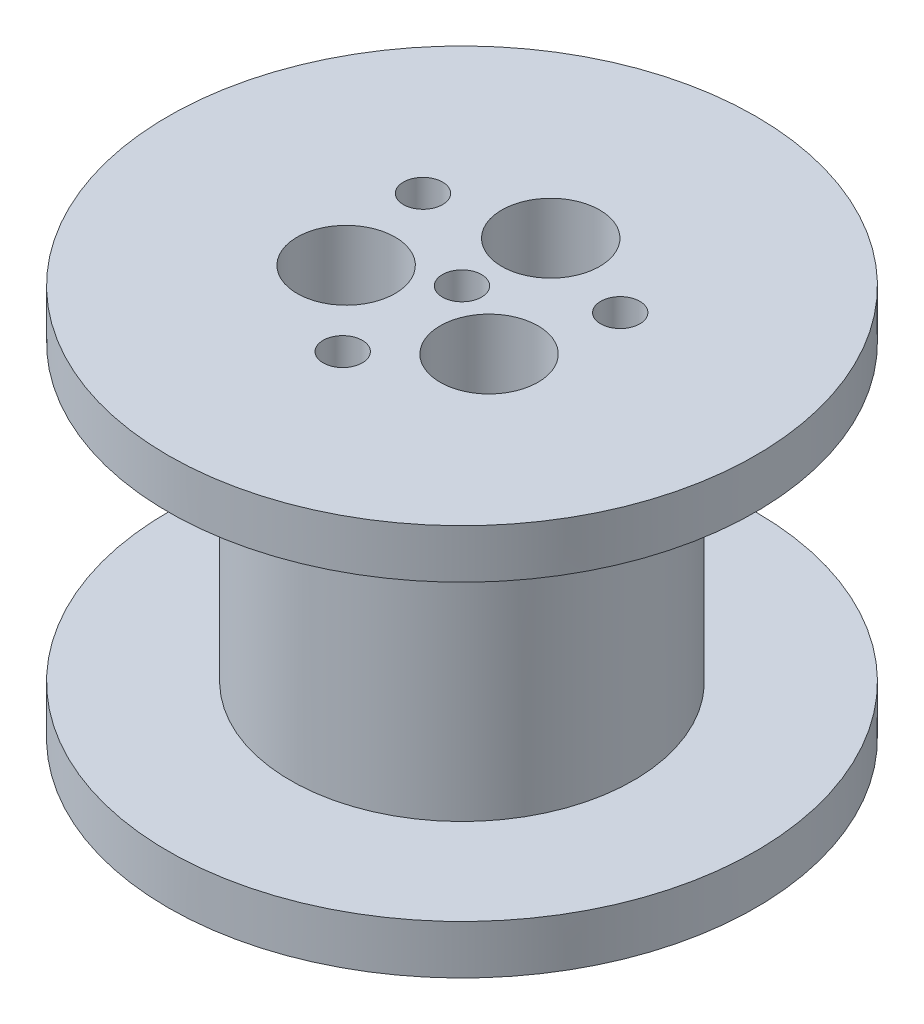
from build123d import *

# Parameters (mm, degrees)
SKETCH1_R           = 30
BOSS_EXTRUDE1_DEPTH = 40
CUT_EXTRUDE1_START  = -5
SKETCH2_OUTSIDE_W   = 80.762
SKETCH2_OUTSIDE_H   = 80.762
SKETCH2_OUTSIDE_R   = 17.5
CUT_EXTRUDE1_DEPTH  = 30
SKETCH3_R           = 2
CUT_EXTRUDE2_DEPTH  = 59.309518948
CUT_EXTRUDE3_DEPTH  = 59.309518948
CUT_EXTRUDE4_REACH  = 57
SKETCH5_R           = 2
SKETCH8_R           = 2
CUT_EXTRUDE5_DEPTH  = 59.309518948


with BuildPart() as part:
    # Sketch1 → Boss-Extrude1 (new body)
    with BuildSketch(Plane(origin=(0, 0, 0), x_dir=(1, 0, 0), z_dir=(0, 1, 0))):
        with Locations(Location((0, 0, 0), (0, 0, 270))):
            Circle(SKETCH1_R)
    extrude(amount=BOSS_EXTRUDE1_DEPTH)

    # Sketch2 outside → Cut-Extrude1 (cut)
    with BuildSketch(Plane.XZ.offset(CUT_EXTRUDE1_START)):
        Rectangle(SKETCH2_OUTSIDE_W, SKETCH2_OUTSIDE_H)
        with Locations(Location((0, 0, 0), (0, 0, 270))):
            Circle(SKETCH2_OUTSIDE_R, mode=Mode.SUBTRACT)
    extrude(amount=-CUT_EXTRUDE1_DEPTH, mode=Mode.SUBTRACT)

    # Sketch3 → Cut-Extrude2 (cut, through all)
    with BuildSketch(Plane.XZ):
        with Locations(Location((0, 0, 0), (0, 0, 270))):
            Circle(SKETCH3_R)
    extrude(amount=-CUT_EXTRUDE2_DEPTH, mode=Mode.SUBTRACT)

    # Sketch4 → Cut-Extrude3 (cut, through all)
    with BuildSketch(Plane.XZ):
        with BuildLine():
            ThreePointArc((5.314601624, -8.562564428), (0.136244015, -3.747524192), (-4.678796221, -8.925881801))
            Line((-4.678796221, -8.925881801), (5.314601624, -8.562564428))
        make_face()
        with BuildLine():
            Line((5.314601624, -8.562564428), (-4.678796221, -8.925881801))
            ThreePointArc((-4.678796221, -8.925881801), (0.40874704, -13.743397777), (5.317902702, -8.744223114))
            ThreePointArc((5.317902702, -8.744223114), (5.317077364, -8.653378776), (5.314601624, -8.562564428))
        make_face()
        with BuildLine():
            ThreePointArc((4.758097504, 8.883862231), (3.177329144, 1.991752874), (10.069438501, 0.410984514))
            Line((10.069438501, 0.410984514), (4.758097504, 8.883862231))
        make_face()
        with BuildLine():
            Line((4.758097504, 8.883862231), (10.069438501, 0.410984514))
            ThreePointArc((10.069438501, 0.410984514), (11.788602428, 2.226509547), (12.413768003, 4.647423373))
            ThreePointArc((12.413768003, 4.647423373), (9.834681829, 9.022257798), (4.758097504, 8.883862231))
        make_face()
        with BuildLine():
            ThreePointArc((-5.39064228, 8.514897287), (-12.149768249, 6.437828165), (-10.072699128, -0.321297804))
            Line((-10.072699128, -0.321297804), (-5.39064228, 8.514897287))
        make_face()
        with BuildLine():
            Line((-5.39064228, 8.514897287), (-10.072699128, -0.321297804))
            ThreePointArc((-10.072699128, -0.321297804), (-5.153409868, -0.187190345), (-2.731670704, 4.096799742))
            ThreePointArc((-2.731670704, 4.096799742), (-3.447680618, 6.675060578), (-5.39064228, 8.514897287))
        make_face()
    extrude(amount=-CUT_EXTRUDE3_DEPTH, mode=Mode.SUBTRACT)

    # Sketch5 → Cut-Extrude4 (cut, up to next)
    with BuildSketch(Plane(origin=(0, 5, 0), x_dir=(1, 0, 0), z_dir=(0, 1, 0)), mode=Mode.PRIVATE) as cut_extrude4_sk1:
        with Locations(Location((-15.339737127, 8.422734999, 0), (0, 0, 270))):
            Circle(SKETCH5_R)
    cut_extrude4_tool1 = extrude(cut_extrude4_sk1.sketch, amount=-CUT_EXTRUDE4_REACH, mode=Mode.PRIVATE) & part.part
    add(cut_extrude4_tool1.solids().sort_by_distance((-15.339737, 5, -8.422735))[0], mode=Mode.SUBTRACT)

    # Sketch8 → Cut-Extrude5 (cut, through all)
    with BuildSketch(Plane(origin=(0, 40, 0), x_dir=(1, 0, 0), z_dir=(0, 1, 0))):
        with Locations(Location((-0.274503836, -11.904684903, 0), (0, 0, 270))):
            Circle(SKETCH8_R)
        with Locations(Location((10.446409645, 5.714285954, 0), (0, 0, 270))):
            Circle(SKETCH8_R)
        with Locations(Location((-10.172001933, 6.189762023, 0), (0, 0, 270))):
            Circle(SKETCH8_R)
    extrude(amount=-CUT_EXTRUDE5_DEPTH, mode=Mode.SUBTRACT)


solid = part.part
